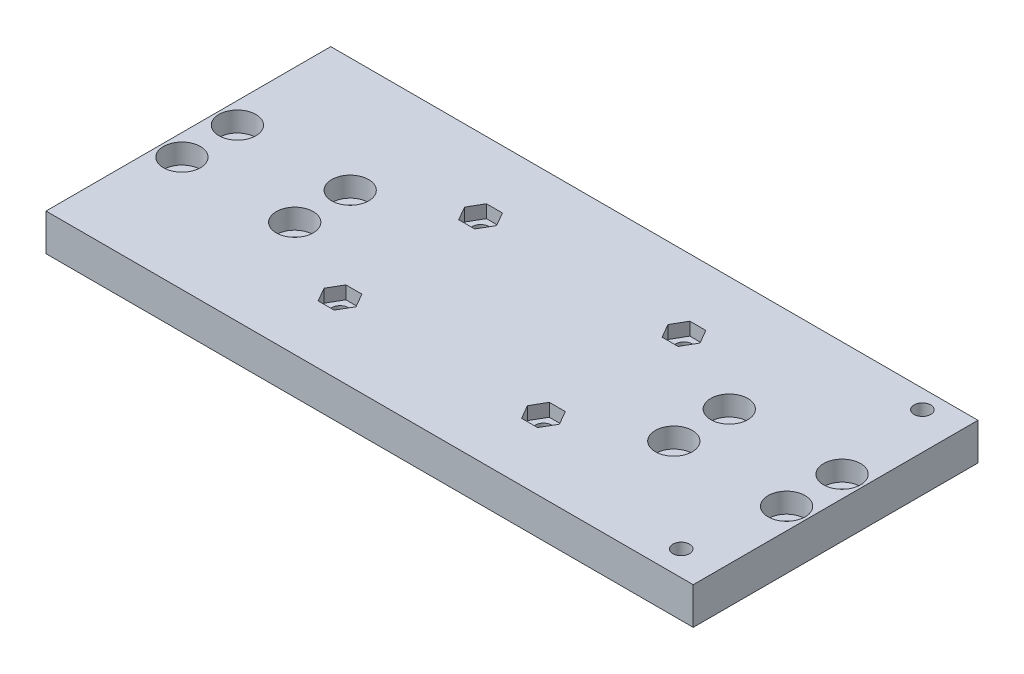
from build123d import *

# Parameters (mm, degrees)
SKETCH1_W                                           = 175
SKETCH1_H                                           = 77
BOSS_EXTRUDE1_DEPTH                                 = 10
CBORE_FOR_M5_HEX_SOCKET_HEAD_CAP_SCREW3_D           = 5.5
CBORE_FOR_M5_HEX_SOCKET_HEAD_CAP_SCREW3_CBORE_D     = 10
CBORE_FOR_M5_HEX_SOCKET_HEAD_CAP_SCREW3_CBORE_DEPTH = 5.4
M4_CLEARANCE_HOLE1_D                                = 4.5
CUT_EXTRUDE1_DEPTH                                  = 3.5
M4_CLEARANCE_HOLE2_D                                = 4.5
CUT_EXTRUDE2_DEPTH                                  = 3.5


with BuildPart() as part:
    # Sketch1 → Boss-Extrude1 (new body)
    with BuildSketch(Plane(origin=(0, 0, 0), x_dir=(1, 0, 0), z_dir=(0, 1, 0))):
        Rectangle(SKETCH1_W, SKETCH1_H)
    extrude(amount=BOSS_EXTRUDE1_DEPTH)

    # CBORE for M5 Hex Socket Head Cap Screw3 (through all)
    with Locations(Plane(origin=(-81.75, 10, 7.5), x_dir=(0, 0, 1), z_dir=(0, 1, 0))):
        with Locations((0, 0), (-15, 0), (-15, 30.5), (0, 30.5), (0, 133), (-15, 133), (-15, 163.5), (0, 163.5)):
            CounterBoreHole(CBORE_FOR_M5_HEX_SOCKET_HEAD_CAP_SCREW3_D / 2, CBORE_FOR_M5_HEX_SOCKET_HEAD_CAP_SCREW3_CBORE_D / 2, CBORE_FOR_M5_HEX_SOCKET_HEAD_CAP_SCREW3_CBORE_DEPTH)

    # M4 Clearance Hole1 (through all)
    with Locations(Plane(origin=(77.5, 10, 31.75), x_dir=(0, 0, 1), z_dir=(0, 1, 0))):
        with Locations((0, 0), (-65.21, 0)):
            Hole(M4_CLEARANCE_HOLE1_D / 2)

    # Sketch9 → Cut-Extrude1 (cut)
    with BuildSketch(Plane.XZ):
        Polygon((81.830127019, 31.75), (79.665063509, 35.5), (75.334936491, 35.5), (73.169872981, 31.75), (75.334936491, 28), (79.665063509, 28), align=None)
        Polygon((79.665063509, -29.71), (75.334936491, -29.71), (73.169872981, -33.46), (75.334936491, -37.21), (79.665063509, -37.21), (81.830127019, -33.46), align=None)
    extrude(amount=-CUT_EXTRUDE1_DEPTH, mode=Mode.SUBTRACT)

    # M4 Clearance Hole2 (through all)
    with Locations(Plane(origin=(-27.5, 0, 19), x_dir=(0, 0, -1), z_dir=(0, -1, 0))):
        with Locations((0, 0), (0, 55), (38, 0), (38, 55)):
            Hole(M4_CLEARANCE_HOLE2_D / 2)

    # Sketch12 → Cut-Extrude2 (cut)
    with BuildSketch(Plane(origin=(0, 10, 0), x_dir=(1, 0, 0), z_dir=(0, 1, 0))):
        Polygon((-23.169872981, 19), (-25.334936491, 22.75), (-29.665063509, 22.75), (-31.830127019, 19), (-29.665063509, 15.25), (-25.334936491, 15.25), align=None)
        Polygon((31.830127019, 19), (29.665063509, 22.75), (25.334936491, 22.75), (23.169872981, 19), (25.334936491, 15.25), (29.665063509, 15.25), align=None)
        Polygon((31.830127019, -19), (29.665063509, -15.25), (25.334936491, -15.25), (23.169872981, -19), (25.334936491, -22.75), (29.665063509, -22.75), align=None)
        Polygon((-23.169872981, -19), (-25.334936491, -15.25), (-29.665063509, -15.25), (-31.830127019, -19), (-29.665063509, -22.75), (-25.334936491, -22.75), align=None)
    extrude(amount=-CUT_EXTRUDE2_DEPTH, mode=Mode.SUBTRACT)


solid = part.part
